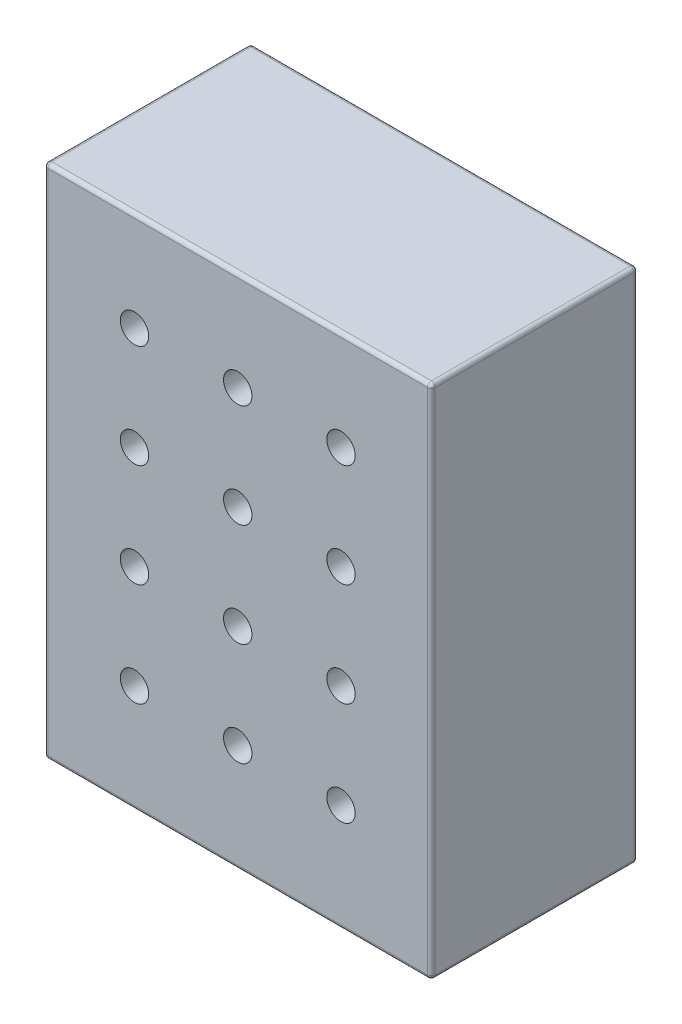
from build123d import *

# Parameters (mm, degrees)
SKETCH1_W           = 300
SKETCH1_H           = 400
SKETCH1_R           = 11
BOSS_EXTRUDE1_DEPTH = 160
FILLET1_R           = 3


with BuildPart() as part:
    # Sketch1 → Boss-Extrude1 (new body)
    with BuildSketch(Plane.XY):
        with Locations((511.639721418, 643.529340403)):
            Rectangle(SKETCH1_W, SKETCH1_H)
        with Locations((431.639721418, 526.80715456)):
            Circle(SKETCH1_R, mode=Mode.SUBTRACT)
        with Locations((431.639721418, 606.80715456)):
            Circle(SKETCH1_R, mode=Mode.SUBTRACT)
        with Locations((431.639721418, 686.80715456)):
            Circle(SKETCH1_R, mode=Mode.SUBTRACT)
        with Locations((431.639721418, 766.80715456)):
            Circle(SKETCH1_R, mode=Mode.SUBTRACT)
        with Locations((511.639721418, 526.80715456)):
            Circle(SKETCH1_R, mode=Mode.SUBTRACT)
        with Locations((511.639721418, 606.80715456)):
            Circle(SKETCH1_R, mode=Mode.SUBTRACT)
        with Locations((511.639721418, 686.80715456)):
            Circle(SKETCH1_R, mode=Mode.SUBTRACT)
        with Locations((511.639721418, 766.80715456)):
            Circle(SKETCH1_R, mode=Mode.SUBTRACT)
        with Locations((591.639721418, 526.80715456)):
            Circle(SKETCH1_R, mode=Mode.SUBTRACT)
        with Locations((591.639721418, 606.80715456)):
            Circle(SKETCH1_R, mode=Mode.SUBTRACT)
        with Locations((591.639721418, 686.80715456)):
            Circle(SKETCH1_R, mode=Mode.SUBTRACT)
        with Locations((591.639721418, 766.80715456)):
            Circle(SKETCH1_R, mode=Mode.SUBTRACT)
    extrude(amount=BOSS_EXTRUDE1_DEPTH)

    # Fillet1
    fillet1_edges = [part.edges().sort_by_distance(p)[0] for p in [
        (661.639721418, 643.529340403, 160),
        (511.639721418, 843.529340403, 160),
        (361.639721418, 643.529340403, 160),
        (511.639721418, 843.529340403, 0),
        (661.639721418, 643.529340403, 0),
        (511.639721418, 443.529340403, 0),
        (361.639721418, 643.529340403, 0),
        (361.639721418, 843.529340403, 80),
        (661.639721418, 843.529340403, 80),
        (661.639721418, 443.529340403, 80),
        (361.639721418, 443.529340403, 80),
        (511.639721418, 443.529340403, 160),
    ]]
    fillet(fillet1_edges, radius=FILLET1_R)


solid = part.part
